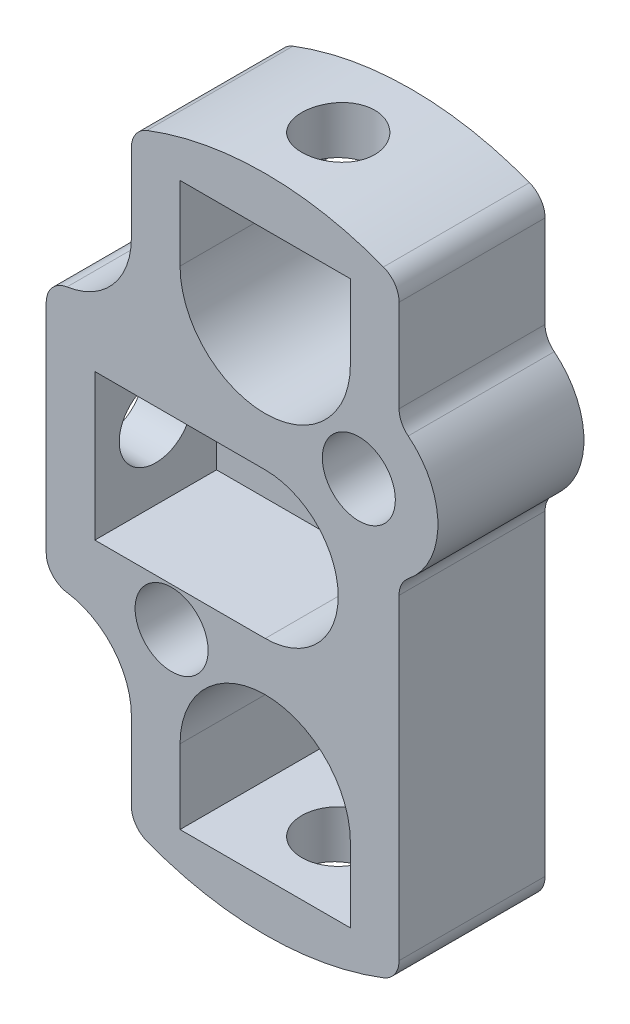
from build123d import *

# Parameters (mm, degrees)
ESQUISSE1_R             = 1.5
BOSS_EXTRU_1_DEPTH      = 5
BOSS_EXTRU_2_START      = -1
ESQUISSE1_3_R           = 1.5
BOSS_EXTRU_2_DEPTH      = 1
ESQUISSE2_R             = 1.5
ENL_V_MAT_EXTRU_2_DEPTH = 28.129504234
ESQUISSE3_R             = 1.5
ENL_V_MAT_EXTRU_3_DEPTH = 21.182147001


with BuildPart() as part:
    # Esquisse1 → Boss.-Extru.1 (new body)
    with BuildSketch(Plane.XY):
        with BuildLine():
            ThreePointArc((-8.145422919, 5.437314339), (-8.756777021, 5.101617869), (-9, 4.447944754))
            Line((-9, 4.447944754), (-9, -4.447944754))
            ThreePointArc((-9, -4.447944754), (-8.756777021, -5.101617869), (-8.145422919, -5.437314339))
            ThreePointArc((-8.145422919, -5.437314339), (-6.252919377, -6.476494015), (-5.5, -8.5))
            Line((-5.5, -8.5), (-5.5, -11.715481211))
            ThreePointArc((-5.5, -11.715481211), (-5.324186186, -12.281800142), (-4.858565737, -12.64898569))
            ThreePointArc((-4.858565737, -12.64898569), (0, -13.55), (4.858565737, -12.64898569))
            ThreePointArc((4.858565737, -12.64898569), (5.324186186, -12.281800142), (5.5, -11.715481211))
            Line((5.5, -11.715481211), (5.5, 1.284668728))
            ThreePointArc((5.5, 1.284668728), (5.598803794, 1.718080078), (5.875690797, 2.065846057))
            ThreePointArc((5.875690797, 2.065846057), (7.096685887, 4.604672376), (5.875690797, 7.143498694))
            ThreePointArc((5.875690797, 7.143498694), (5.598803794, 7.491264673), (5.5, 7.924676023))
            Line((5.5, 7.924676023), (5.5, 11.715481211))
            ThreePointArc((5.5, 11.715481211), (5.324186186, 12.281800142), (4.858565737, 12.64898569))
            ThreePointArc((4.858565737, 12.64898569), (0, 13.55), (-4.858565737, 12.64898569))
            ThreePointArc((-4.858565737, 12.64898569), (-5.324186186, 12.281800142), (-5.5, 11.715481211))
            Line((-5.5, 11.715481211), (-5.5, 8.5))
            ThreePointArc((-5.5, 8.5), (-6.252919377, 6.476494015), (-8.145422919, 5.437314339))
        make_face()
        with Locations((-3.846685887, -4.604672376)):
            Circle(ESQUISSE1_R, mode=Mode.SUBTRACT)
        with BuildLine():
            ThreePointArc((3, 0), (2.121320344, -2.121320344), (0, -3))
            Line((0, -3), (-7, -3))
            Line((-7, -3), (-7, 3))
            Line((-7, 3), (0, 3))
            ThreePointArc((0, 3), (2.121320344, 2.121320344), (3, 0))
        make_face(mode=Mode.SUBTRACT)
        with BuildLine():
            Line((3.5, -11.55), (-3.5, -11.55))
            Line((-3.5, -11.55), (-3.5, -8.5))
            ThreePointArc((-3.5, -8.5), (0, -5), (3.5, -8.5))
            Line((3.5, -8.5), (3.5, -11.55))
        make_face(mode=Mode.SUBTRACT)
        with Locations((3.846685887, 4.604672376)):
            Circle(ESQUISSE1_R, mode=Mode.SUBTRACT)
        with BuildLine():
            Line((-3.5, 8.5), (-3.5, 11.55))
            Line((-3.5, 11.55), (3.5, 11.55))
            Line((3.5, 11.55), (3.5, 8.5))
            ThreePointArc((3.5, 8.5), (0, 5), (-3.5, 8.5))
        make_face(mode=Mode.SUBTRACT)
    extrude(amount=BOSS_EXTRU_1_DEPTH)

    # Esquisse1<3> → Boss.-Extru.2 (add)
    with BuildSketch(Plane.XY.offset(BOSS_EXTRU_2_START)):
        with BuildLine():
            ThreePointArc((-8.145422919, 5.437314339), (-8.756777021, 5.101617869), (-9, 4.447944754))
            Line((-9, 4.447944754), (-9, -4.447944754))
            ThreePointArc((-9, -4.447944754), (-8.756777021, -5.101617869), (-8.145422919, -5.437314339))
            ThreePointArc((-8.145422919, -5.437314339), (-6.252919377, -6.476494015), (-5.5, -8.5))
            Line((-5.5, -8.5), (-5.5, -11.715481211))
            ThreePointArc((-5.5, -11.715481211), (-5.324186186, -12.281800142), (-4.858565737, -12.64898569))
            ThreePointArc((-4.858565737, -12.64898569), (0, -13.55), (4.858565737, -12.64898569))
            ThreePointArc((4.858565737, -12.64898569), (5.324186186, -12.281800142), (5.5, -11.715481211))
            Line((5.5, -11.715481211), (5.5, 1.284668728))
            ThreePointArc((5.5, 1.284668728), (5.598803794, 1.718080078), (5.875690797, 2.065846057))
            ThreePointArc((5.875690797, 2.065846057), (7.096685887, 4.604672376), (5.875690797, 7.143498694))
            ThreePointArc((5.875690797, 7.143498694), (5.598803794, 7.491264673), (5.5, 7.924676023))
            Line((5.5, 7.924676023), (5.5, 11.715481211))
            ThreePointArc((5.5, 11.715481211), (5.324186186, 12.281800142), (4.858565737, 12.64898569))
            ThreePointArc((4.858565737, 12.64898569), (0, 13.55), (-4.858565737, 12.64898569))
            ThreePointArc((-4.858565737, 12.64898569), (-5.324186186, 12.281800142), (-5.5, 11.715481211))
            Line((-5.5, 11.715481211), (-5.5, 8.5))
            ThreePointArc((-5.5, 8.5), (-6.252919377, 6.476494015), (-8.145422919, 5.437314339))
        make_face()
        with Locations((-3.846685887, -4.604672376)):
            Circle(ESQUISSE1_3_R, mode=Mode.SUBTRACT)
        with BuildLine():
            ThreePointArc((3.5, 8.5), (0, 5), (-3.5, 8.5))
            Line((-3.5, 8.5), (-3.5, 11.55))
            Line((-3.5, 11.55), (3.5, 11.55))
            Line((3.5, 11.55), (3.5, 8.5))
        make_face(mode=Mode.SUBTRACT)
        with BuildLine():
            Line((3.5, -11.55), (-3.5, -11.55))
            Line((-3.5, -11.55), (-3.5, -8.5))
            ThreePointArc((-3.5, -8.5), (0, -5), (3.5, -8.5))
            Line((3.5, -8.5), (3.5, -11.55))
        make_face(mode=Mode.SUBTRACT)
        with Locations((3.846685887, 4.604672376)):
            Circle(ESQUISSE1_3_R, mode=Mode.SUBTRACT)
    extrude(amount=BOSS_EXTRU_2_DEPTH)

    # Esquisse2 → Enlèv. mat.-Extru.2 (cut, through all)
    with BuildSketch(Plane.XZ.offset(-11.55)):
        with Locations((0, 2)):
            Circle(ESQUISSE2_R)
    enl_v_mat_extru_2 = extrude(amount=-ENL_V_MAT_EXTRU_2_DEPTH, mode=Mode.SUBTRACT)

    # Symétrie1: Enlèv. mat.-Extru.2 across plane
    add(enl_v_mat_extru_2.mirror(Plane.ZX), mode=Mode.SUBTRACT)

    # Esquisse3 → Enlèv. mat.-Extru.3 (cut, through all)
    with BuildSketch(Plane(origin=(-7, 0, 0), x_dir=(0, 0, -1), z_dir=(1, 0, 0))):
        with Locations((-2.5, 0)):
            Circle(ESQUISSE3_R)
    extrude(amount=-ENL_V_MAT_EXTRU_3_DEPTH, mode=Mode.SUBTRACT)


solid = part.part
